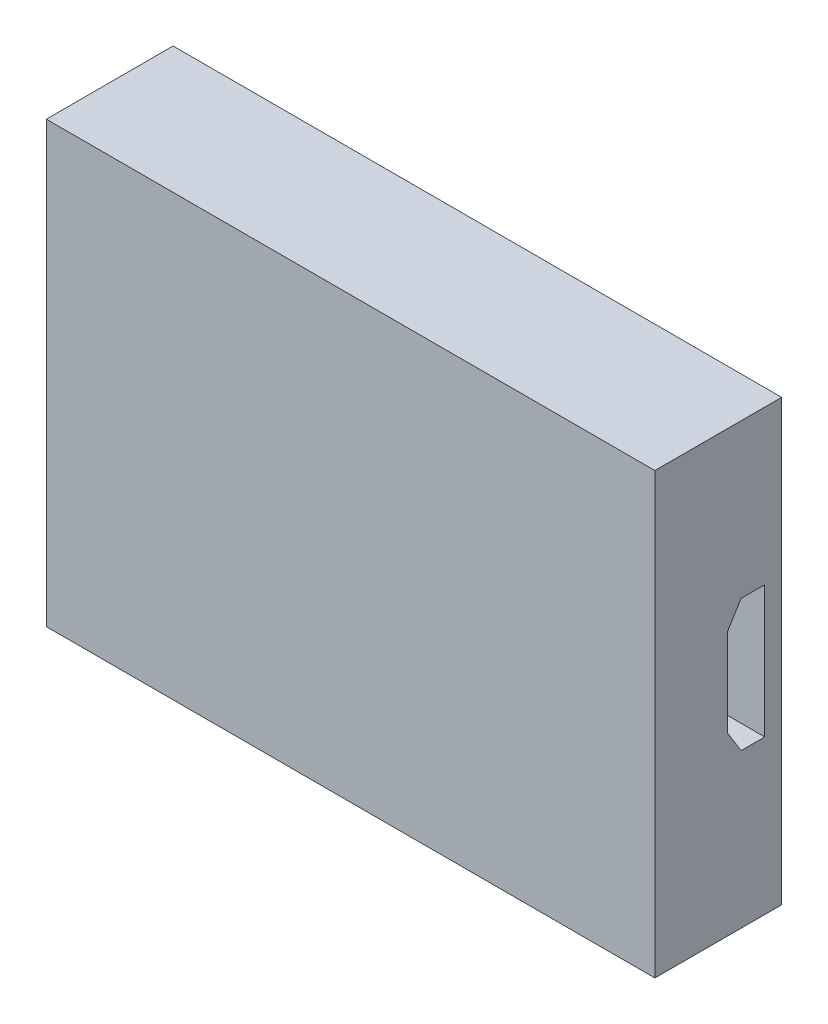
from build123d import *

# Parameters (mm, degrees)
SKETCH1_W           = 36
SKETCH1_H           = 26
SKETCH1_W_2         = 30
SKETCH1_H_2         = 20
EXTRUDE_THIN1_DEPTH = 5.5
CUT_EXTRUDE1_REACH  = 40.668
SKETCH1_4_W         = 36
SKETCH1_4_H         = 26
SKETCH1_4_W_2       = 30
SKETCH1_4_H_2       = 20
BOSS_EXTRUDE3_DEPTH = 2
SKETCH4_R           = 1.25
CUT_EXTRUDE4_DEPTH  = 5
CUT_EXTRUDE5_REACH  = 40.668
SKETCH5_R           = 0.5


with BuildPart() as part:
    # Sketch1 → Extrude-Thin1 (new body)
    with BuildSketch(Plane.XY):
        with Locations((-1.25, 0)):
            Rectangle(SKETCH1_W, SKETCH1_H)
        with Locations((-1.25, 0)):
            Rectangle(SKETCH1_W_2, SKETCH1_H_2, mode=Mode.SUBTRACT)
    extrude(amount=-EXTRUDE_THIN1_DEPTH)

    # Sketch2 → Cut-Extrude1 (cut, up to next)
    with BuildSketch(Plane(origin=(16.75, 0, 0), x_dir=(0, 0, -1), z_dir=(1, 0, 0)), mode=Mode.PRIVATE) as cut_extrude1_sk1:
        Polygon((4.5, -3.9), (4.5, 3.9), (3.1, 3.9), (2.3, 2.6), (2.3, 0), (2.3, -2.6), (3.1, -3.9), align=None)
    cut_extrude1_tool1 = extrude(cut_extrude1_sk1.sketch, amount=-CUT_EXTRUDE1_REACH, mode=Mode.PRIVATE) & part.part
    add(cut_extrude1_tool1.solids().sort_by_distance((16.75, 0, -3.453763))[0], mode=Mode.SUBTRACT)

    # Sketch1<4> → Boss-Extrude3 (add)
    # profile 1 of 2: a face of its own
    with BuildSketch(Plane.XY):
        with Locations((-1.25, 0)):
            Rectangle(SKETCH1_4_W, SKETCH1_4_H)
        with Locations((-1.25, 0)):
            Rectangle(SKETCH1_4_W_2, SKETCH1_4_H_2, mode=Mode.SUBTRACT)
    # profile 2 of 2: a face of its own
    with BuildSketch(Plane.XY):
        with Locations((-1.25, 0)):
            Rectangle(SKETCH1_4_W_2, SKETCH1_4_H_2)
    extrude(amount=BOSS_EXTRUDE3_DEPTH)

    # Sketch4 → Cut-Extrude4 (cut)
    with BuildSketch(Plane(origin=(0, 0, -5.5), x_dir=(-1, 0, 0), z_dir=(0, 0, -1))):
        with Locations((-14.75, 11)):
            Circle(SKETCH4_R)
        with Locations((17.25, 11)):
            Circle(SKETCH4_R)
        with Locations((17.25, -11)):
            Circle(SKETCH4_R)
        with Locations((-14.75, -11)):
            Circle(SKETCH4_R)
    extrude(amount=-CUT_EXTRUDE4_DEPTH, mode=Mode.SUBTRACT)

    # Sketch5 → Cut-Extrude5 (cut, up to next)
    with BuildSketch(Plane.ZY.offset(19.25), mode=Mode.PRIVATE) as cut_extrude5_sk1:
        with Locations(Location((-2.5, 4.2, 0), (0, 0, 270))):
            Circle(SKETCH5_R)
    cut_extrude5_tool1 = extrude(cut_extrude5_sk1.sketch, amount=-CUT_EXTRUDE5_REACH, mode=Mode.PRIVATE) & part.part
    # Sketch5 → Cut-Extrude5 (cut, up to next)
    with BuildSketch(Plane.ZY.offset(19.25), mode=Mode.PRIVATE) as cut_extrude5_sk2:
        with Locations(Location((-2.5, -4.2, 0), (0, 0, 270))):
            Circle(SKETCH5_R)
    cut_extrude5_tool2 = extrude(cut_extrude5_sk2.sketch, amount=-CUT_EXTRUDE5_REACH, mode=Mode.PRIVATE) & part.part
    add(cut_extrude5_tool1.solids().sort_by_distance((-19.25, 4.2, -2.5))[0], mode=Mode.SUBTRACT)
    add(cut_extrude5_tool2.solids().sort_by_distance((-19.25, -4.2, -2.5))[0], mode=Mode.SUBTRACT)


solid = part.part
